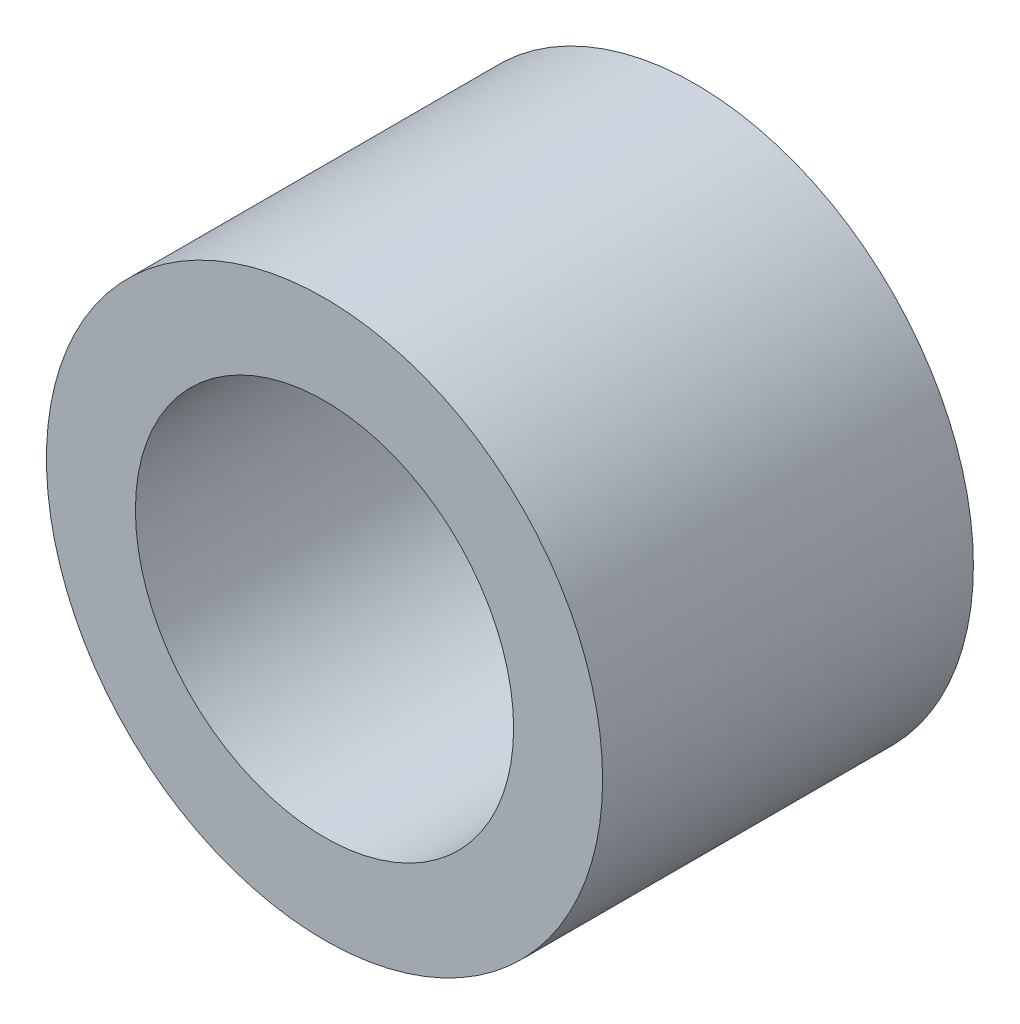
from build123d import *

# Parameters (mm, degrees)
BUSH_PROFILE_R     = 15
BUSH_PROFILE_R_2   = 10.2
BUSH_EXTRUDE_DEPTH = 10


with BuildPart() as part:
    # Bush_Profile → Bush_Extrude (new, symmetric)
    with BuildSketch(Plane.XY):
        Circle(BUSH_PROFILE_R)
        Circle(BUSH_PROFILE_R_2, mode=Mode.SUBTRACT)
    extrude(amount=BUSH_EXTRUDE_DEPTH, both=True)


solid = part.part
